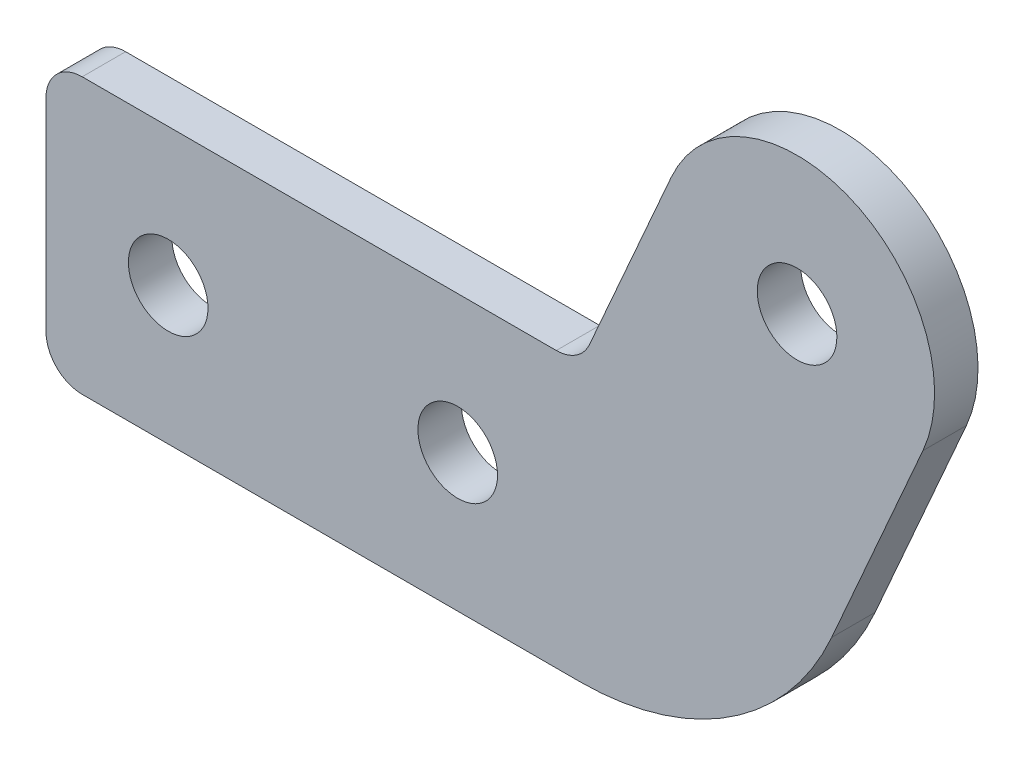
from build123d import *

# Parameters (mm, degrees)
BOSS_EXTRUDE1_DEPTH  = 3
M5_CLEARANCE_HOLE1_D = 5.5
M5_CLEARANCE_HOLE2_D = 5.5
M5_CLEARANCE_HOLE3_D = 5.5
FILLET2_R            = 2.5


with BuildPart() as part:
    # Sketch1 → Boss-Extrude1 (new body)
    with BuildSketch(Plane.XY):
        with BuildLine():
            Line((8.695255676, -3.826555727), (2.390511351, -18.153111454))
            ThreePointArc((2.390511351, -18.153111454), (-4.61754166, -26.412402673), (-15, -29.5))
            Line((-15, -29.5), (-51.88, -29.5))
            Line((-51.88, -29.5), (-51.88, -10.5))
            Line((-51.88, -10.5), (-15, -10.5))
            Line((-15, -10.5), (-8.695255676, 3.826555727))
            ThreePointArc((-8.695255676, 3.826555727), (3.826555727, 8.695255676), (8.695255676, -3.826555727))
        make_face()
    extrude(amount=BOSS_EXTRUDE1_DEPTH)

    # M5 Clearance Hole1 (through all)
    with Locations(Plane.XY.offset(3)):
        with Locations((-43.44, -20)):
            Hole(M5_CLEARANCE_HOLE1_D / 2)

    # M5 Clearance Hole2 (through all)
    with Locations(Plane.XY.offset(3)):
        with Locations((-23.44, -20)):
            Hole(M5_CLEARANCE_HOLE2_D / 2)

    # M5 Clearance Hole3 (through all)
    with Locations(Plane.XY.offset(3)):
        with Locations((0, 0)):
            Hole(M5_CLEARANCE_HOLE3_D / 2)

    # Fillet2
    fillet2_edges = [part.edges().sort_by_distance(p)[0] for p in [
        (-51.88, -29.5, 1.5),
        (-51.88, -10.5, 1.5),
        (-15, -10.5, 1.5),
    ]]
    fillet(fillet2_edges, radius=FILLET2_R)


solid = part.part
